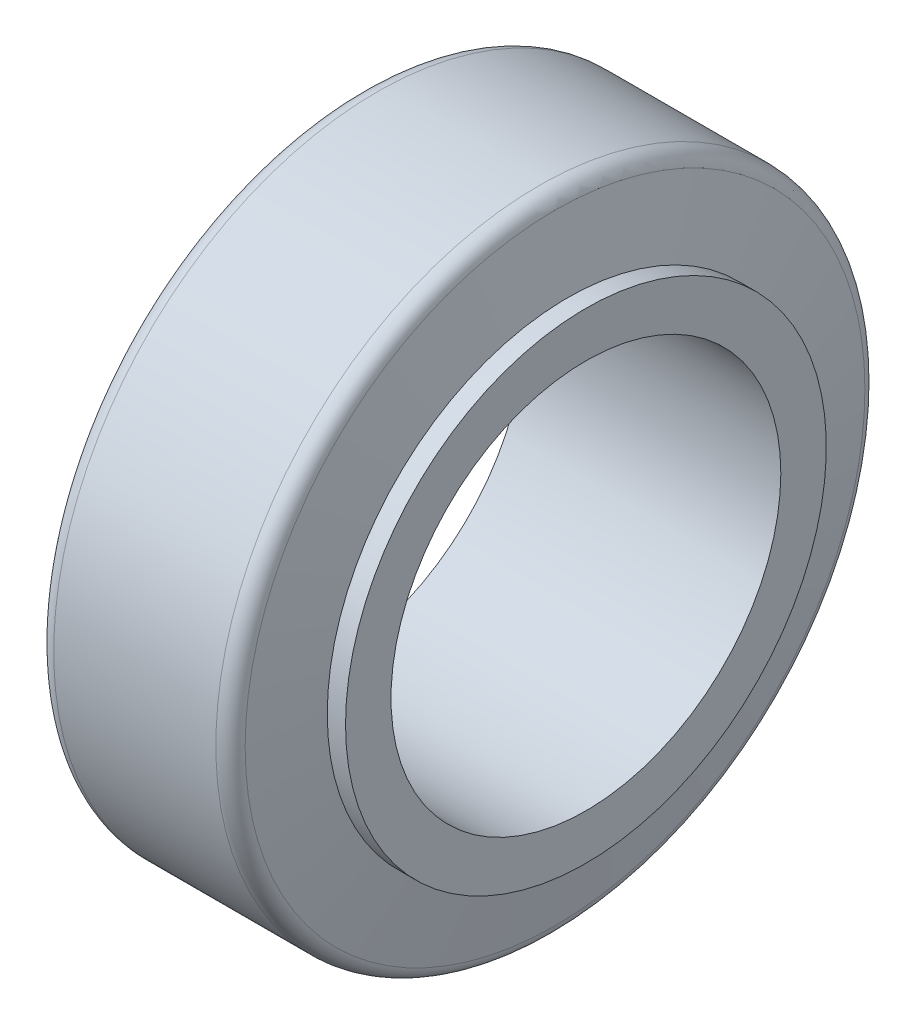
from build123d import *

# Parameters (mm, degrees)
FILLET1_R          = 2
SKETCH2_R          = 24
CUT_EXTRUDE1_DEPTH = 70.225501822


with BuildPart() as part:
    # Sketch1 → Revolve1 (revolve)
    with BuildSketch(Plane.XY, mode=Mode.PRIVATE) as revolve1_sk:
        Polygon((-11.65, -39.8), (11.65, -39.8), (13.5, -29.6), (15.75, -29.6), (15.75, -23.6), (4.25, -20.75), (4.25, -17), (20.15, -15.75), (20.15, -10.05), (-20.15, -10.05), (-20.15, -15.75), (-4.25, -17), (-4.25, -20.75), (-15.75, -23.6), (-15.75, -29.6), (-13.5, -29.6), align=None)
    revolve(revolve1_sk.sketch.rotate(Axis((0, 0, 0), (1, 0, 0)), 270), axis=Axis((0, 0, 0), (1, 0, 0)))

    # Fillet1
    fillet1_edges = [part.edges().sort_by_distance(p)[0] for p in [
        (11.65, 0, -39.8),
        (-11.65, 0, -39.8),
        (-4.25, 0, -20.75),
        (-4.25, 0, -17),
        (-20.15, 0, -15.75),
        (20.15, 0, -15.75),
        (4.25, 0, -17),
        (4.25, 0, -20.75),
    ]]
    fillet(fillet1_edges, radius=FILLET1_R)

    # Sketch2 → Cut-Extrude1 (cut, through all)
    with BuildSketch(Plane(origin=(20.15, 0, 0), x_dir=(0, 0, -1), z_dir=(1, 0, 0))):
        Circle(SKETCH2_R)
    extrude(amount=-CUT_EXTRUDE1_DEPTH, mode=Mode.SUBTRACT)


solid = part.part
